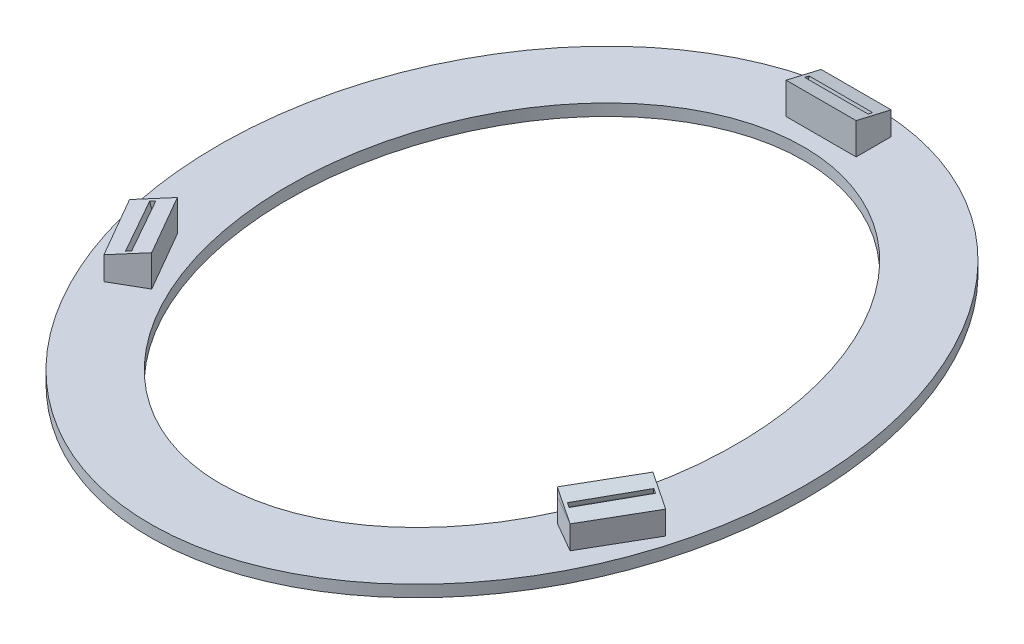
from build123d import *

# Parameters (mm, degrees)
BOSS_EXTRUDE1_DEPTH     = 5
SKETCH2_W               = 30
SKETCH2_H               = 15
BOSS_EXTRUDE2_DEPTH     = 10
BOSS_EXTRUDE3_DEPTH     = 30
SKETCH6_W               = 13.6
SKETCH6_H               = 1
CUT_EXTRUDE2_DEPTH      = 12
BOSS_EXTRUDE4_DEPTH     = 10
BOSS_EXTRUDE5_DEPTH     = 30
CUT_EXTRUDE3_DEPTH      = 12
BOSS_EXTRUDE6_DEPTH     = 10
BOSS_EXTRUDE7_DEPTH     = 30
CUT_EXTRUDE4_DEPTH      = 213.980952646
CUT_EXTRUDE4_DEPTH_BACK = 12


with BuildPart() as part:
    # Sketch1 → Boss-Extrude1 (new body)
    with BuildSketch(Plane(origin=(0, 0, 0), x_dir=(1, 0, 0), z_dir=(0, 1, 0))):
        with BuildLine():
            Line((0, -155), (0, -125))
            add(Edge.make_bspline(
                [(-96, 0), (-96, -125), (0, -125)],
                knots=[4.71238898, 4.71238898, 4.71238898, 6.283185307, 6.283185307, 6.283185307], degree=2, weights=[1, 0.707106781, 1]))
            Line((-96, 0), (-126, 0))
            add(Edge.make_bspline(
                [(-126, 0), (-126, -155), (0, -155)],
                knots=[1.570796327, 1.570796327, 1.570796327, 3.141592654, 3.141592654, 3.141592654], degree=2, weights=[1, 0.707106781, 1]))
        make_face()
        with BuildLine():
            add(Edge.make_bspline(
                [(0, -125), (96, -125), (96, 0)],
                knots=[0, 0, 0, 1.570796327, 1.570796327, 1.570796327], degree=2, weights=[1, 0.707106781, 1]))
            Line((0, -125), (0, -155))
            add(Edge.make_bspline(
                [(0, -155), (126, -155), (126, 0)],
                knots=[3.141592654, 3.141592654, 3.141592654, 4.71238898, 4.71238898, 4.71238898], degree=2, weights=[1, 0.707106781, 1]))
            Line((126, 0), (96, 0))
        make_face()
        with BuildLine():
            Line((0, 155), (0, 125))
            add(Edge.make_bspline(
                [(96, 0), (96, 125), (0, 125)],
                knots=[1.570796327, 1.570796327, 1.570796327, 3.141592654, 3.141592654, 3.141592654], degree=2, weights=[1, 0.707106781, 1]))
            Line((96, 0), (126, 0))
            add(Edge.make_bspline(
                [(126, 0), (126, 155), (0, 155)],
                knots=[4.71238898, 4.71238898, 4.71238898, 6.283185307, 6.283185307, 6.283185307], degree=2, weights=[1, 0.707106781, 1]))
        make_face()
        with BuildLine():
            add(Edge.make_bspline(
                [(0, 125), (-96, 125), (-96, 0)],
                knots=[3.141592654, 3.141592654, 3.141592654, 4.71238898, 4.71238898, 4.71238898], degree=2, weights=[1, 0.707106781, 1]))
            Line((0, 125), (0, 155))
            add(Edge.make_bspline(
                [(0, 155), (-126, 155), (-126, 0)],
                knots=[0, 0, 0, 1.570796327, 1.570796327, 1.570796327], degree=2, weights=[1, 0.707106781, 1]))
            Line((-126, 0), (-96, 0))
        make_face()
    extrude(amount=BOSS_EXTRUDE1_DEPTH)

    # Sketch2 → Boss-Extrude2 (add)
    with BuildSketch(Plane(origin=(0, 5, 0), x_dir=(1, 0, 0), z_dir=(0, 1, 0))):
        with Locations((0, 140)):
            Rectangle(SKETCH2_W, SKETCH2_H)
    extrude(amount=BOSS_EXTRUDE2_DEPTH)

    # Sketch5 → Boss-Extrude3 (add)
    with BuildSketch(Plane.ZY.offset(15)):
        Polygon((-147.5, 15), (-132.5, 15), (-132.5, 18.5), align=None)
    extrude(amount=-BOSS_EXTRUDE3_DEPTH)

    # Sketch6 → Cut-Extrude2 (cut)
    with BuildSketch(Plane(origin=(0, 46.86512118, -10.935194942), x_dir=(1, 0, 0), z_dir=(0, 0.9738412097417932, -0.22722961560641866))):
        with Locations((-6.8, 132.031673302)):
            Rectangle(SKETCH6_W, SKETCH6_H)
        with Locations((-6.8, 133.031673302)):
            Rectangle(SKETCH6_W, SKETCH6_H)
        with Locations((6.8, 132.031673302)):
            Rectangle(SKETCH6_W, SKETCH6_H)
        with Locations((6.8, 133.031673302)):
            Rectangle(SKETCH6_W, SKETCH6_H)
    extrude(amount=-CUT_EXTRUDE2_DEPTH, mode=Mode.SUBTRACT)

    # Sketch8 → Boss-Extrude4 (add)
    with BuildSketch(Plane(origin=(0, 5, 0), x_dir=(1, 0, 0), z_dir=(0, 1, 0))):
        Polygon((87.920680945, -65.761028811), (113.901443058, -50.761028811), (114.90625253, -49.020647754), (101.915871473, -41.520647754), align=None)
        Polygon((99.90625253, -75.001409868), (113.901443058, -50.761028811), (87.920680945, -65.761028811), (86.915871473, -67.501409868), align=None)
    extrude(amount=BOSS_EXTRUDE4_DEPTH)


with BuildPart() as body_2:
    # Sketch9 → Boss-Extrude5 (new body)
    with BuildSketch(Plane(origin=(-7.5, 0, 12.990381057), x_dir=(0.8660254037844436, 0, 0.49999999999999156), z_dir=(-0.4999999999999915, 0, 0.8660254037844435))):
        Polygon((109.022057622, 15), (124.022057622, 15), (109.022057622, 18.5), align=None)
    extrude(amount=-BOSS_EXTRUDE5_DEPTH)


with BuildPart() as cut_extrude3_tool:
    # Sketch11 → Cut-Extrude3 (new body)
    with BuildSketch(Plane(origin=(8.420322862, 41.669791465, 4.861475671), x_dir=(0.9804463403692827, -0.19546089552154577, -0.022803771144179908), z_dir=(0.19678661960733193, 0.9738412097417933, 0.11361480780320707))):
        Polygon((94.335340275, -55.927530645), (93.475091752, -55.417524793), (86.669314871, -67.205476137), (87.399260686, -67.62691055), align=None)
        Polygon((100.269314871, -43.649585154), (93.475091752, -55.417524793), (94.335340275, -55.927530645), (101.271419863, -44.228150741), align=None)
        Polygon((101.271419863, -44.228150741), (94.335340275, -55.927530645), (95.195588797, -56.437536498), (102.001365678, -44.649585154), align=None)
        Polygon((95.195588797, -56.437536498), (94.335340275, -55.927530645), (87.399260686, -67.62691055), (88.401365678, -68.205476137), align=None)
    extrude(amount=-CUT_EXTRUDE3_DEPTH)


with BuildPart() as part_1:
    add(part.part)

    # Cut-Extrude3: cut by cut_extrude3_tool
    add(cut_extrude3_tool.part, mode=Mode.SUBTRACT)

    # Sketch12 → Boss-Extrude6 (add)
    with BuildSketch(Plane(origin=(0, 5, 0), x_dir=(1, 0, 0), z_dir=(0, 1, 0))):
        Polygon((-107.40625253, -62.011028811), (-94.415871473, -54.511028811), (-101.915871473, -41.520647754), (-114.90625253, -49.020647754), align=None)
        Polygon((-86.915871473, -67.501409868), (-94.415871473, -54.511028811), (-107.40625253, -62.011028811), (-99.90625253, -75.001409868), align=None)
    extrude(amount=BOSS_EXTRUDE6_DEPTH)

    # Sketch13 → Boss-Extrude7 (add)
    with BuildSketch(Plane(origin=(7.5, 0, 12.990381057), x_dir=(0.8660254037844365, 0, -0.5000000000000039), z_dir=(0.5000000000000038, 0, 0.8660254037844364))):
        Polygon((-124.022057622, 15), (-109.022057622, 15), (-109.022057622, 18.5), align=None)
    extrude(amount=-BOSS_EXTRUDE7_DEPTH)

    # Sketch14 → Cut-Extrude4 (cut, two sides: drawn at the far end of the back side and taken through both)
    with BuildSketch(Plane(origin=(-8.420322862, 41.669791465, 4.861475671), x_dir=(0.9804463403692829, 0.19546089552154455, 0.022803771144180363), z_dir=(-0.19678661960733076, 0.9738412097417933, 0.11361480780321004)).offset(-CUT_EXTRUDE4_DEPTH_BACK)):
        Polygon((-86.669314871, -67.205476137), (-100.269314871, -43.649585154), (-102.001365678, -44.649585154), (-88.401365678, -68.205476137), align=None)
    extrude(amount=CUT_EXTRUDE4_DEPTH + CUT_EXTRUDE4_DEPTH_BACK, mode=Mode.SUBTRACT)


with BuildPart() as body_2_1:
    add(body_2.part)

    # Cut-Extrude3: cut by cut_extrude3_tool
    add(cut_extrude3_tool.part, mode=Mode.SUBTRACT)


solid = Compound([part_1.part, body_2_1.part])
